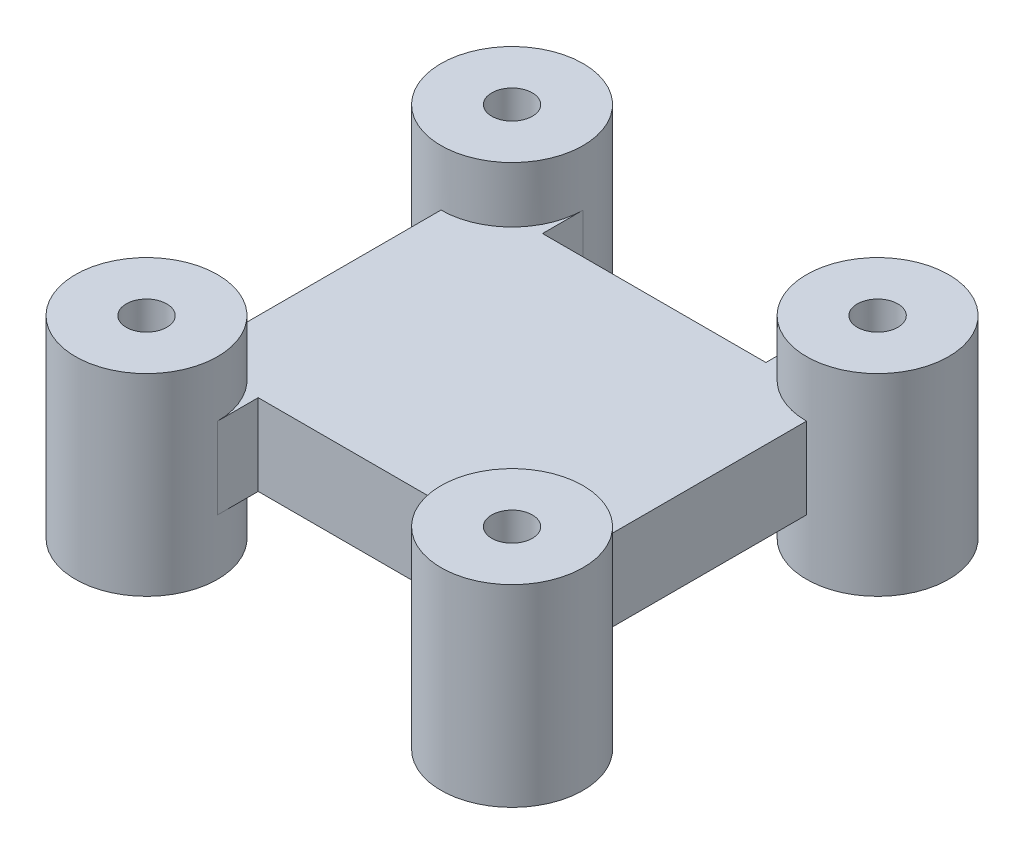
from build123d import *

# Parameters (mm, degrees)
SKETCH1_W           = 22
SKETCH1_H           = 28
BOSS_EXTRUDE1_DEPTH = 8
SKETCH2_R           = 2
CUT_EXTRUDE1_DEPTH  = 37.249137921
SKETCH5_R           = 7
SKETCH5_R_2         = 2
BOSS_EXTRUDE3_DEPTH = 5.5


with BuildPart() as part:
    # Sketch1 → Boss-Extrude1 (new body)
    with BuildSketch(Plane(origin=(0, 0, 0), x_dir=(1, 0, 0), z_dir=(0, 1, 0))):
        with BuildLine():
            ThreePointArc((-18, 11), (-13.050252532, 13.050252532), (-11, 18))
            Line((-11, 18), (-18, 18))
            Line((-18, 18), (-18, 11))
        make_face()
        with BuildLine():
            Line((-18, 18), (-11, 18))
            ThreePointArc((-11, 18), (-22.949747468, 22.949747468), (-18, 11))
            Line((-18, 11), (-18, 18))
        make_face()
        with BuildLine():
            Line((-11, -18), (-11, -14))
            Line((-11, -14), (-11, 14))
            Line((-11, 14), (-11, 18))
            ThreePointArc((-11, 18), (-13.050252532, 13.050252532), (-18, 11))
            Line((-18, 11), (-18, -11))
            ThreePointArc((-18, -11), (-13.050252532, -13.050252532), (-11, -18))
        make_face()
        with BuildLine():
            ThreePointArc((-18, -11), (-22.949747468, -22.949747468), (-11, -18))
            Line((-11, -18), (-18, -18))
            Line((-18, -18), (-18, -11))
        make_face()
        with BuildLine():
            Line((-18, -18), (-11, -18))
            ThreePointArc((-11, -18), (-13.050252532, -13.050252532), (-18, -11))
            Line((-18, -11), (-18, -18))
        make_face()
        Rectangle(SKETCH1_W, SKETCH1_H)
        with BuildLine():
            ThreePointArc((18, -11), (13.050252532, -13.050252532), (11, -18))
            Line((11, -18), (18, -18))
            Line((18, -18), (18, -11))
        make_face()
        with BuildLine():
            Line((18, -18), (11, -18))
            ThreePointArc((11, -18), (18, -25), (25, -18))
            ThreePointArc((25, -18), (22.949747468, -13.050252532), (18, -11))
            Line((18, -11), (18, -18))
        make_face()
        with BuildLine():
            Line((11, 14), (11, -14))
            Line((11, -14), (11, -18))
            ThreePointArc((11, -18), (13.050252532, -13.050252532), (18, -11))
            Line((18, -11), (18, 11))
            ThreePointArc((18, 11), (13.050252532, 13.050252532), (11, 18))
            Line((11, 18), (11, 14))
        make_face()
        with BuildLine():
            ThreePointArc((25, 18), (18, 25), (11, 18))
            Line((11, 18), (18, 18))
            Line((18, 18), (18, 11))
            ThreePointArc((18, 11), (22.949747468, 13.050252532), (25, 18))
        make_face()
        with BuildLine():
            Line((18, 18), (11, 18))
            ThreePointArc((11, 18), (13.050252532, 13.050252532), (18, 11))
            Line((18, 11), (18, 18))
        make_face()
    extrude(amount=BOSS_EXTRUDE1_DEPTH)

    # Sketch2 → Cut-Extrude1 (cut, through all)
    with BuildSketch(Plane(origin=(0, 8, 0), x_dir=(1, 0, 0), z_dir=(0, 1, 0))):
        with Locations(Location((-18, 18, 0), (0, 0, 270))):
            Circle(SKETCH2_R)
        with Locations(Location((-18, -18, 0), (0, 0, 270))):
            Circle(SKETCH2_R)
        with Locations(Location((18, -18, 0), (0, 0, 270))):
            Circle(SKETCH2_R)
        with Locations(Location((18, 18, 0), (0, 0, 270))):
            Circle(SKETCH2_R)
    extrude(amount=-CUT_EXTRUDE1_DEPTH, mode=Mode.SUBTRACT)

    # Sketch5 → Boss-Extrude3 (add)
    # profile 1 of 4: a face of its own
    with BuildSketch(Plane.XZ):
        with Locations(Location((-18, 18, 0), (0, 0, 270))):
            Circle(SKETCH5_R)
        with Locations(Location((-18, 18, 0), (0, 0, 90))):
            Circle(SKETCH5_R_2, mode=Mode.SUBTRACT)
    # profile 2 of 4: a face of its own
    with BuildSketch(Plane.XZ):
        with Locations(Location((18, 18, 0), (0, 0, 270))):
            Circle(SKETCH5_R)
        with Locations(Location((18, 18, 0), (0, 0, 90))):
            Circle(SKETCH5_R_2, mode=Mode.SUBTRACT)
    # profile 3 of 4: a face of its own
    with BuildSketch(Plane.XZ):
        with Locations(Location((18, -18, 0), (0, 0, 270))):
            Circle(SKETCH5_R)
        with Locations(Location((18, -18, 0), (0, 0, 90))):
            Circle(SKETCH5_R_2, mode=Mode.SUBTRACT)
    # profile 4 of 4: a face of its own
    with BuildSketch(Plane.XZ):
        with Locations(Location((-18, -18, 0), (0, 0, 270))):
            Circle(SKETCH5_R)
        with Locations(Location((-18, -18, 0), (0, 0, 90))):
            Circle(SKETCH5_R_2, mode=Mode.SUBTRACT)
    boss_extrude3 = extrude(amount=BOSS_EXTRUDE3_DEPTH)

    # Mirror1: Boss-Extrude3 across plane
    add(boss_extrude3.mirror(Plane.ZX.offset(4)))


solid = part.part
